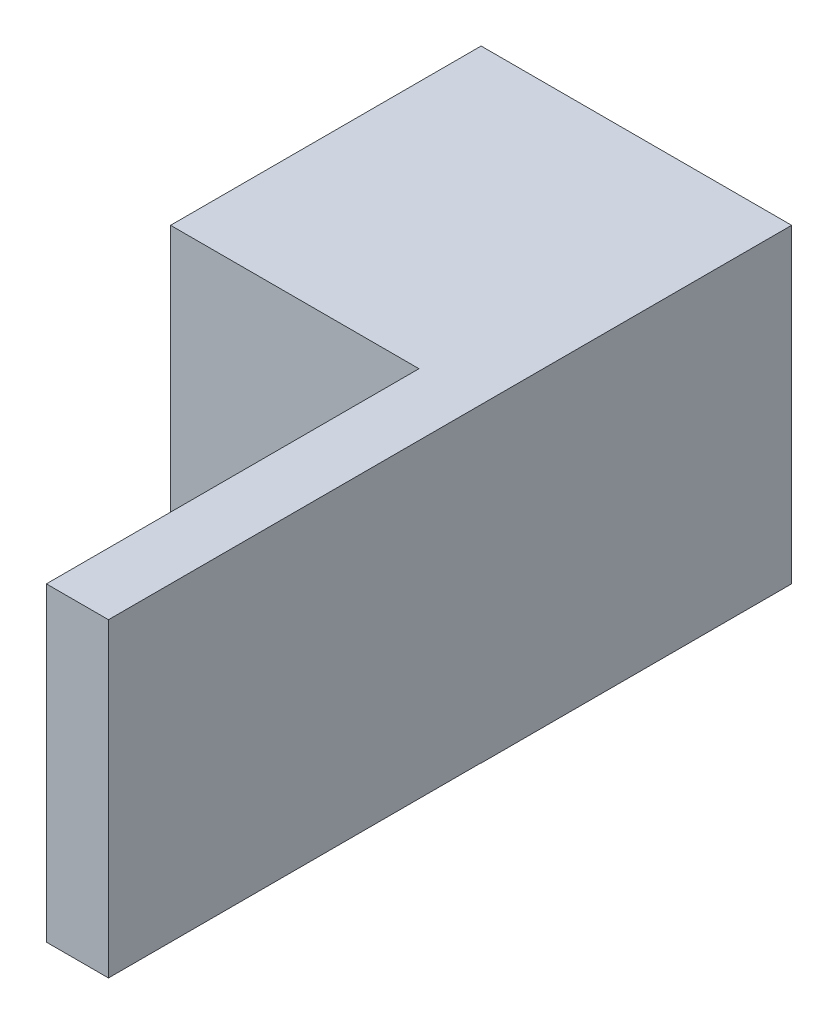
from build123d import *

# Parameters (mm, degrees)
SKETCH1_W           = 500
SKETCH1_H           = 500
BOSS_EXTRUDE1_DEPTH = 500
SKETCH2_W           = 100
SKETCH2_H           = 499.616763286
BOSS_EXTRUDE2_DEPTH = 1100


with BuildPart() as part:
    # Sketch1 → Boss-Extrude1 (new body)
    with BuildSketch(Plane.XY):
        with Locations((-207.735203718, -250)):
            Rectangle(SKETCH1_W, SKETCH1_H)
    extrude(amount=BOSS_EXTRUDE1_DEPTH)

    # Sketch2 → Boss-Extrude2 (add)
    with BuildSketch(Plane(origin=(0, 0, 0), x_dir=(-1, 0, 0), z_dir=(0, 0, -1))):
        with Locations((7.735203718, -249.808381643)):
            Rectangle(SKETCH2_W, SKETCH2_H)
    extrude(amount=-BOSS_EXTRUDE2_DEPTH)


solid = part.part
